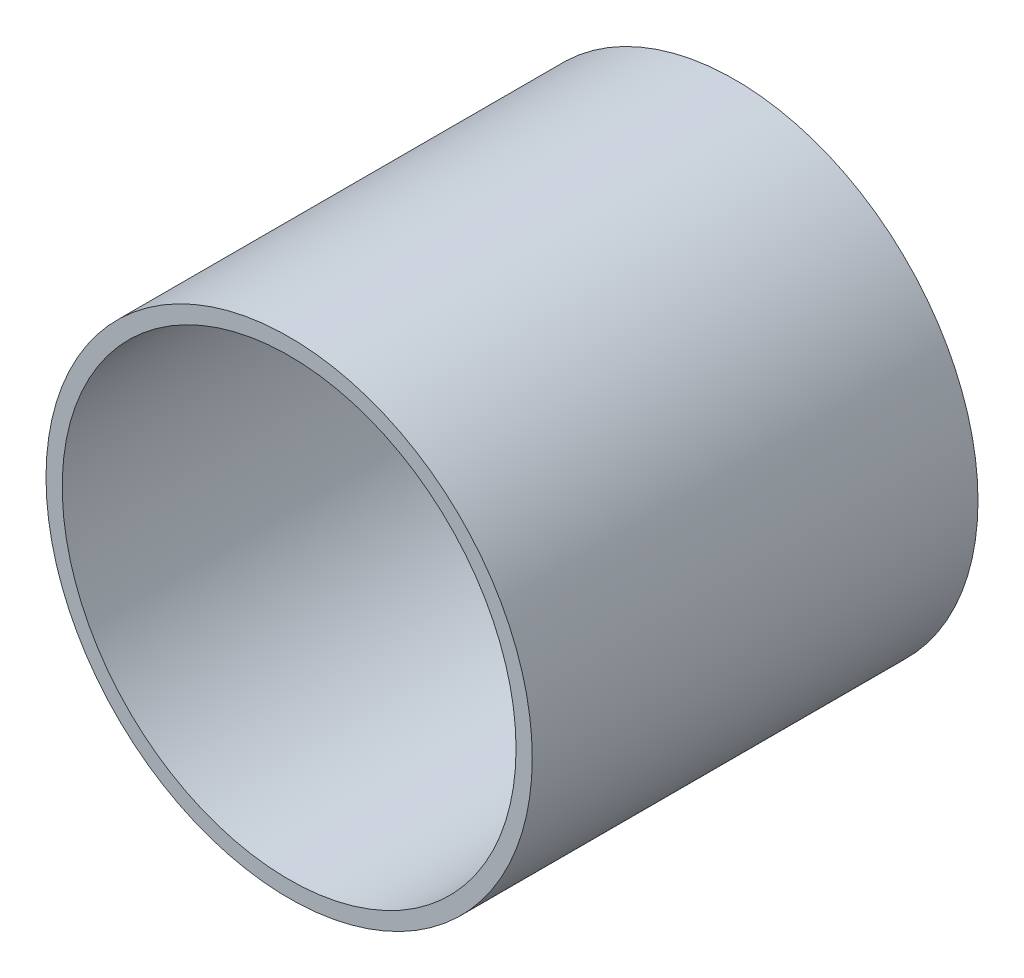
from build123d import *

# Parameters (mm, degrees)
SKETCH1_R           = 3.81
BOSS_EXTRUDE1_DEPTH = 3.4925
SKETCH2_R           = 3.556
CUT_EXTRUDE1_DEPTH  = 9.821701933


with BuildPart() as part:
    # Sketch1 → Boss-Extrude1 (new, symmetric)
    with BuildSketch(Plane.XY):
        Circle(SKETCH1_R)
    extrude(amount=BOSS_EXTRUDE1_DEPTH, both=True)

    # Sketch2 → Cut-Extrude1 (cut, through all)
    with BuildSketch(Plane.XY.offset(3.4925)):
        Circle(SKETCH2_R)
    extrude(amount=-CUT_EXTRUDE1_DEPTH, mode=Mode.SUBTRACT)


solid = part.part
